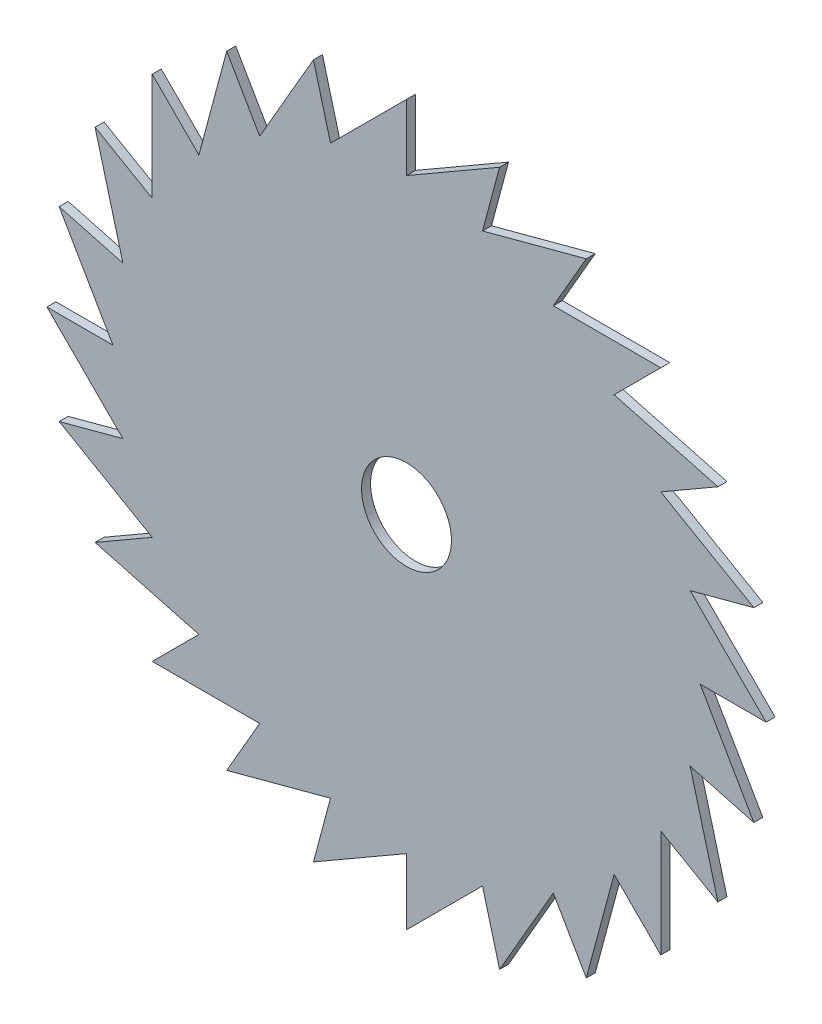
from build123d import *

# Parameters (mm, degrees)
SKETCH1_R           = 5
BOSS_EXTRUDE1_DEPTH = 1


with BuildPart() as part:
    # Sketch1 → Boss-Extrude1 (new body)
    with BuildSketch(Plane.XY):
        Polygon((0, 40), (0, 32.659863237), (10.352761804, 38.637033052), (8.452994616, 31.547005384), (20, 34.641016151), (16.329931619, 28.284271247), (28.284271247, 28.284271247), (23.094010768, 23.094010768), (34.641016151, 20), (28.284271247, 16.329931619), (38.637033052, 10.352761804), (31.547005384, 8.452994616), (40, 0), (32.659863237, 0), (38.637033052, -10.352761804), (31.547005384, -8.452994616), (34.641016151, -20), (28.284271247, -16.329931619), (28.284271247, -28.284271247), (23.094010768, -23.094010768), (20, -34.641016151), (16.329931619, -28.284271247), (10.352761804, -38.637033052), (8.452994616, -31.547005384), (0, -40), (0, -32.659863237), (-10.352761804, -38.637033052), (-8.452994616, -31.547005384), (-20, -34.641016151), (-16.329931619, -28.284271247), (-28.284271247, -28.284271247), (-23.094010768, -23.094010768), (-34.641016151, -20), (-28.284271247, -16.329931619), (-38.637033052, -10.352761804), (-31.547005384, -8.452994616), (-40, 0), (-32.659863237, 0), (-38.637033052, 10.352761804), (-31.547005384, 8.452994616), (-34.641016151, 20), (-28.284271247, 16.329931619), (-28.284271247, 28.284271247), (-23.094010768, 23.094010768), (-20, 34.641016151), (-16.329931619, 28.284271247), (-10.352761804, 38.637033052), (-8.452994616, 31.547005384), align=None)
        Circle(SKETCH1_R, mode=Mode.SUBTRACT)
    extrude(amount=BOSS_EXTRUDE1_DEPTH)


solid = part.part
